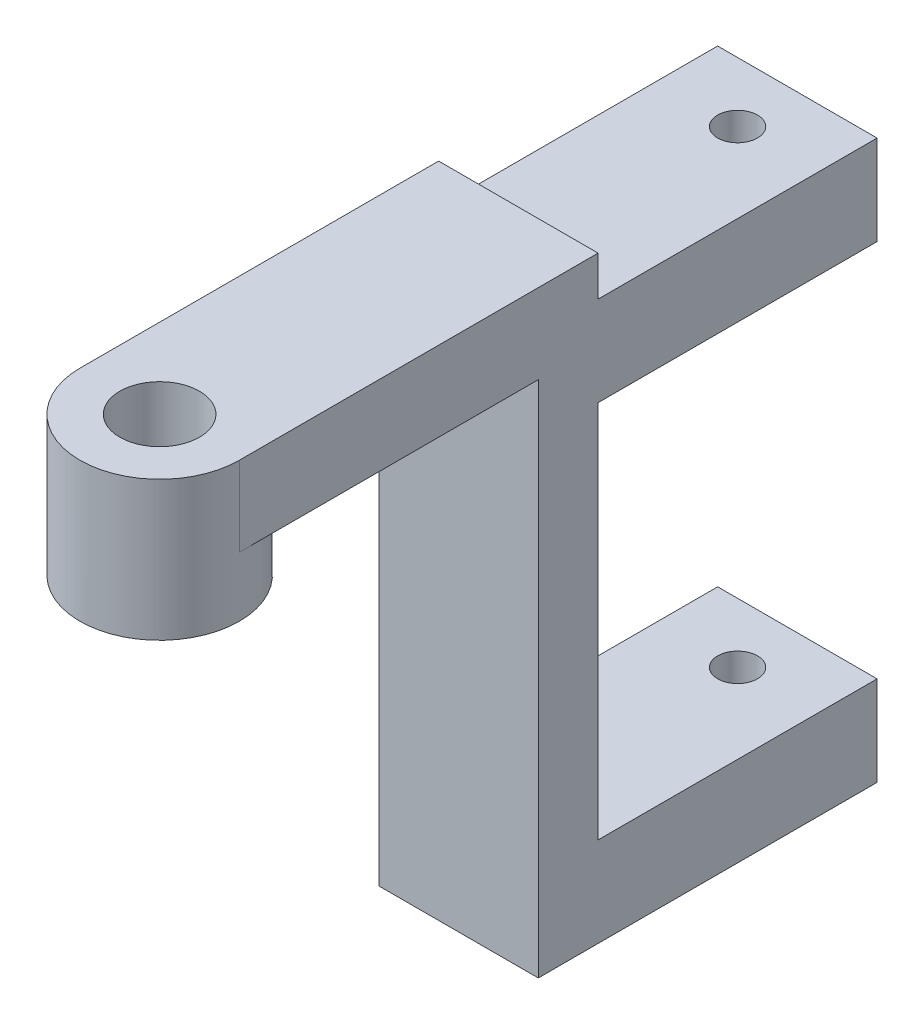
from build123d import *

# Parameters (mm, degrees)
SKETCH_1_R               = 4
SKETCH_1_R_2             = 2
EXTRUDE_1_DEPTH          = 3
SKETCH_2_R               = 4
SKETCH_2_R_2             = 2
EXTRUDE_1_2_DEPTH        = 2
EXTRUDE_2_DEPTH          = 2
EXTRUDE_2_DEPTH_BACK     = 2
SKETCH_4_W               = 8
SKETCH_4_H               = 26
SKETCH_4_H_2             = 4
EXTRUDE_3_DEPTH          = 3
SKETCH_5_W               = 8
SKETCH_5_H               = 4.5
EXTRUDE_4_DEPTH          = 14
CUT_EXTRUDE_1_DEPTH      = 26
CUT_EXTRUDE_1_DEPTH_BACK = 40.903007405
SKETCH_6_R               = 1
CUT_EXTRUDE_START        = -3
SKETCH_7_R               = 2
CUT_EXTRUDE_2_DEPTH      = 3
CUT_EXTRUDE_3_REACH      = 44.059
SKETCH_8_R               = 0.5


with BuildPart() as part:
    # 草图1 → Extrude 1 (new body)
    with BuildSketch(Plane(origin=(0, 0, 0), x_dir=(1, 0, 0), z_dir=(0, 1, 0))):
        Circle(SKETCH_1_R)
        Circle(SKETCH_1_R_2, mode=Mode.SUBTRACT)
    extrude(amount=EXTRUDE_1_DEPTH)

    # 草图2 → Extrude 1 2 (add)
    # profile 1 of 2: a face of its own
    with BuildSketch(Plane(origin=(0, 3, 0), x_dir=(1, 0, 0), z_dir=(0, 1, 0))):
        Circle(SKETCH_2_R)
        with Locations(Location((0, 0, 0), (0, 0, 270))):
            Circle(SKETCH_2_R_2, mode=Mode.SUBTRACT)
    # profile 2 of 2: a face of its own
    with BuildSketch(Plane(origin=(0, 3, 0), x_dir=(1, 0, 0), z_dir=(0, 1, 0))):
        with Locations(Location((0, 0, 0), (0, 0, 270))):
            Circle(SKETCH_2_R_2)
    extrude(amount=EXTRUDE_1_2_DEPTH)

    # 草图3 → 凸台-拉伸2 (add, two sides: drawn at the far end of the back side and taken through both)
    with BuildSketch(Plane(origin=(0, 5, 0), x_dir=(1, 0, 0), z_dir=(0, 1, 0)).offset(-EXTRUDE_2_DEPTH_BACK)):
        with BuildLine():
            ThreePointArc((4, 0), (0, 4), (-4, 0))
            Line((-4, 0), (4, 0))
        make_face()
        with BuildLine():
            Line((4, 0), (-4, 0))
            ThreePointArc((-4, 0), (0, -4), (4, 0))
        make_face()
        with BuildLine():
            ThreePointArc((4, 0), (0, 4), (-4, 0))
            Line((-4, 0), (4, 0))
        make_face()
        with BuildLine():
            Line((4, 0), (-4, 0))
            ThreePointArc((-4, 0), (0, -4), (4, 0))
        make_face()
        with BuildLine():
            Line((4, 15), (-4, 15))
            Line((-4, 15), (-4, 0))
            ThreePointArc((-4, 0), (0, 4), (4, 0))
            Line((4, 0), (4, 15))
        make_face()
    extrude(amount=EXTRUDE_2_DEPTH + EXTRUDE_2_DEPTH_BACK)

    # 草图4 → 凸台-拉伸3 (add)
    with BuildSketch(Plane(origin=(0, 0, -15), x_dir=(-1, 0, 0), z_dir=(0, 0, -1))):
        with Locations((0, -10)):
            Rectangle(SKETCH_4_W, SKETCH_4_H)
        with Locations((0, 5)):
            Rectangle(SKETCH_4_W, SKETCH_4_H_2)
    extrude(amount=EXTRUDE_3_DEPTH)

    # 草图5 → 凸台-拉伸4 (add)
    with BuildSketch(Plane(origin=(0, 0, -18), x_dir=(-1, 0, 0), z_dir=(0, 0, -1))):
        with Locations((0, 2.75)):
            Rectangle(SKETCH_5_W, SKETCH_5_H)
        with Locations((0, -20.75)):
            Rectangle(SKETCH_5_W, SKETCH_5_H)
    extrude(amount=EXTRUDE_4_DEPTH)

    # 草图6 → 切除-拉伸1 (cut, two sides: drawn at the far end of the back side and taken through both)
    with BuildSketch(Plane.XZ.offset(-0.5).offset(-CUT_EXTRUDE_1_DEPTH_BACK)):
        with Locations(Location((0, -29, 0), (0, 0, 90))):
            Circle(SKETCH_6_R)
    extrude(amount=CUT_EXTRUDE_1_DEPTH + CUT_EXTRUDE_1_DEPTH_BACK, mode=Mode.SUBTRACT)

    # 草图7 → 切除-拉伸2 (cut)
    with BuildSketch(Plane(origin=(0, 7, 0), x_dir=(1, 0, 0), z_dir=(0, 1, 0)).offset(CUT_EXTRUDE_START)):
        with Locations(Location((0, 0, 0), (0, 0, 270))):
            Circle(SKETCH_7_R)
    extrude(amount=CUT_EXTRUDE_2_DEPTH, mode=Mode.SUBTRACT)

    # 草图8 → 切除-拉伸3 (cut, up to next)
    with BuildSketch(Plane(origin=(0, 4, 0), x_dir=(1, 0, 0), z_dir=(0, 1, 0)), mode=Mode.PRIVATE) as cut_extrude_3_sk1:
        with Locations(Location((0, 0, 0), (0, 0, 270))):
            Circle(SKETCH_8_R)
    cut_extrude_3_tool1 = extrude(cut_extrude_3_sk1.sketch, amount=-CUT_EXTRUDE_3_REACH, mode=Mode.PRIVATE) & part.part
    add(cut_extrude_3_tool1.solids().sort_by_distance((0, 4, 0))[0], mode=Mode.SUBTRACT)


solid = part.part
